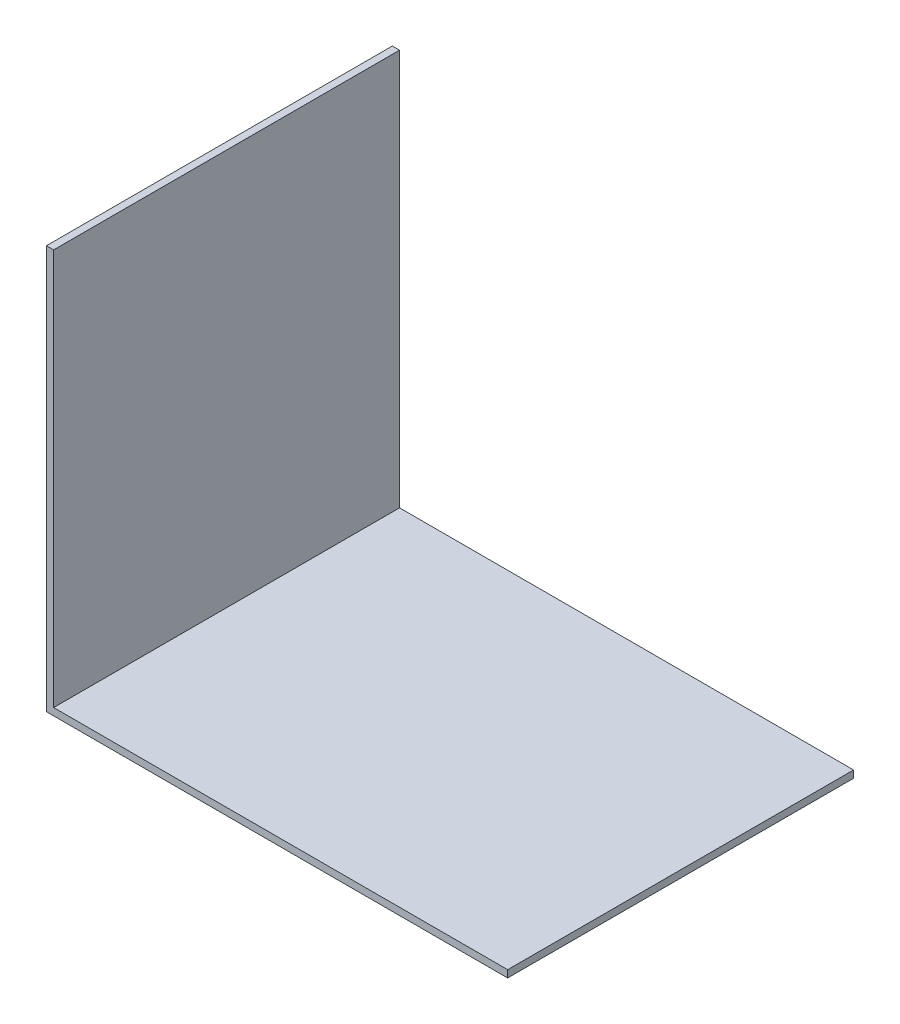
from build123d import *

# Parameters (mm, degrees)
BOSS_EXTRUDE1_DEPTH = 152.4


with BuildPart() as part:
    # Sketch2 → Boss-Extrude1 (new body)
    with BuildSketch(Plane.XY):
        Polygon((21.113251485, 199.585646973), (21.113251485, 21.785646973), (224.313251485, 21.785646973), (224.313251485, 24.960646973), (24.288251485, 24.960646973), (24.288251485, 199.585646973), align=None)
    extrude(amount=BOSS_EXTRUDE1_DEPTH)


solid = part.part
